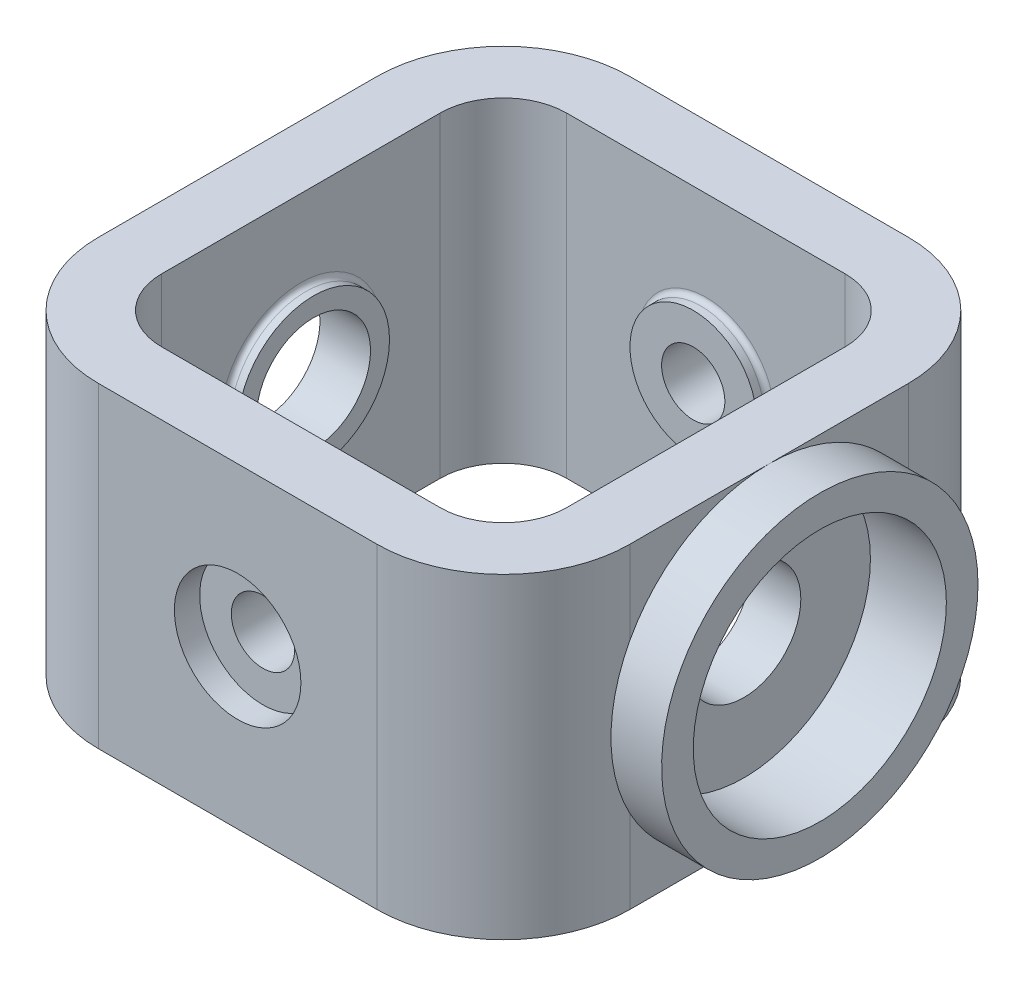
from build123d import *

# Parameters (mm, degrees)
RESSALTO_EXTRUS_O1_DEPTH = 12.5
ESBO_O5_R                = 5
RESSALTO_EXTRUS_O2_DEPTH = 1
ESBO_O6_R                = 5
RESSALTO_EXTRUS_O3_DEPTH = 1
ESBO_O2_R                = 2.5
CORTE_EXTRUS_O1_DEPTH    = 49.592694924
ESBO_O3_R                = 2.5
CORTE_EXTRUS_O2_DEPTH    = 49.592694924
ESBO_O7_R                = 5
CORTE_EXTRUS_O3_DEPTH    = 2
ESCALA1_SCALE            = 0.5
CROQUIS4_R               = 5
CORTAR_EXTRUIR3_DEPTH    = 1
CROQUIS9_R               = 2.25
CORTAR_EXTRUIR6_DEPTH    = 24.437416667
CROQUIS10_R              = 2.851109387
CORTAR_EXTRUIR7_DEPTH    = 16
CORTAR_EXTRUIR8_START    = -1
CROQUIS11_R              = 5
CORTAR_EXTRUIR8_DEPTH    = 1
CROQUIS13_R              = 2.5
CROQUIS13_R_2            = 1.25
CORTAR_EXTRUIR9_DEPTH    = 1
CROQUIS12_R              = 3
CROQUIS12_R_2            = 2.25
SALIENTE_EXTRUIR3_DEPTH  = 0.5
REDONDEO1_R              = 0.2
CROQUIS14_R              = 6.25
CROQUIS14_R_2            = 5
SALIENTE_EXTRUIR5_DEPTH  = 2


with BuildPart() as part:
    # Esboço1 → Ressalto-extrusão1 (new, symmetric)
    with BuildSketch(Plane(origin=(0, 0, 0), x_dir=(1, 0, 0), z_dir=(0, 1, 0))):
        with BuildLine():
            Line((-21, -11), (-21, 11))
            ThreePointArc((-21, 11), (-18.071067812, 18.071067812), (-11, 21))
            Line((-11, 21), (11, 21))
            ThreePointArc((11, 21), (18.071067812, 18.071067812), (21, 11))
            Line((21, 11), (21, -11))
            ThreePointArc((21, -11), (18.071067812, -18.071067812), (11, -21))
            Line((11, -21), (-11, -21))
            ThreePointArc((-11, -21), (-18.071067812, -18.071067812), (-21, -11))
        make_face()
        with BuildLine():
            Line((-11, -16), (11, -16))
            ThreePointArc((11, -16), (14.535533906, -14.535533906), (16, -11))
            Line((16, -11), (16, 11))
            ThreePointArc((16, 11), (14.535533906, 14.535533906), (11, 16))
            Line((11, 16), (-11, 16))
            ThreePointArc((-11, 16), (-14.535533906, 14.535533906), (-16, 11))
            Line((-16, 11), (-16, -11))
            ThreePointArc((-16, -11), (-14.535533906, -14.535533906), (-11, -16))
        make_face(mode=Mode.SUBTRACT)
    extrude(amount=RESSALTO_EXTRUS_O1_DEPTH, both=True)

    # Esboço5 → Ressalto-extrusão2 (add)
    with BuildSketch(Plane.XY.offset(-16)):
        Circle(ESBO_O5_R)
    ressalto_extrus_o2 = extrude(amount=RESSALTO_EXTRUS_O2_DEPTH)

    # Espelhar1: Ressalto-extrusão2 across plane
    add(ressalto_extrus_o2.mirror(Plane.XY))

    # Esboço6 → Ressalto-extrusão3 (add)
    with BuildSketch(Plane(origin=(-16, 0, 0), x_dir=(0, 0, -1), z_dir=(1, 0, 0))):
        Circle(ESBO_O6_R)
    ressalto_extrus_o3 = extrude(amount=RESSALTO_EXTRUS_O3_DEPTH)

    # Espelhar2: Ressalto-extrusão3 across plane
    add(ressalto_extrus_o3.mirror(Plane(origin=(0, 0, 0), x_dir=(0, 0, 1), z_dir=(1, 0, 0))))

    # Esboço2 → Corte-extrusão1 (cut, through all)
    with BuildSketch(Plane.XY.offset(21)):
        Circle(ESBO_O2_R)
    extrude(amount=-CORTE_EXTRUS_O1_DEPTH, mode=Mode.SUBTRACT)

    # Esboço3 → Corte-extrusão2 (cut, through all)
    with BuildSketch(Plane.ZY.offset(21)):
        Circle(ESBO_O3_R)
    extrude(amount=-CORTE_EXTRUS_O2_DEPTH, mode=Mode.SUBTRACT)

    # Esboço7 → Corte-extrusão3 (cut)
    with BuildSketch(Plane(origin=(21, 0, 0), x_dir=(0, 0, -1), z_dir=(1, 0, 0))):
        Circle(ESBO_O7_R)
    corte_extrus_o3 = extrude(amount=-CORTE_EXTRUS_O3_DEPTH, mode=Mode.SUBTRACT)

    # Espelhar3: Corte-extrusão3 across plane
    add(corte_extrus_o3.mirror(Plane(origin=(0, 0, 0), x_dir=(0, 0, 1), z_dir=(1, 0, 0))), mode=Mode.SUBTRACT)


with BuildPart() as part_1:
    # Escala1: scaled about (0, 0, 0)
    add(part.part.scale(ESCALA1_SCALE))

    # Croquis4 → Cortar-Extruir3 (cut)
    with BuildSketch(Plane.ZY.offset(10.5)):
        Circle(CROQUIS4_R)
    extrude(amount=-CORTAR_EXTRUIR3_DEPTH, mode=Mode.SUBTRACT)

    # Croquis9 → Cortar-Extruir6 (cut, through all)
    with BuildSketch(Plane.ZY.offset(9.5)):
        Circle(CROQUIS9_R)
    extrude(amount=-CORTAR_EXTRUIR6_DEPTH, mode=Mode.SUBTRACT)

    # Croquis10 → Cortar-Extruir7 (cut)
    with BuildSketch(Plane.ZY.offset(-8)):
        Circle(CROQUIS10_R)
    extrude(amount=CORTAR_EXTRUIR7_DEPTH, mode=Mode.SUBTRACT)

    # Croquis11 → Cortar-Extruir8 (cut)
    with BuildSketch(Plane(origin=(10.5, 0, 0), x_dir=(0, 0, -1), z_dir=(1, 0, 0)).offset(CORTAR_EXTRUIR8_START)):
        with Locations(Location((0, 0, 0), (0, 0, 180))):
            Circle(CROQUIS11_R)
    extrude(amount=CORTAR_EXTRUIR8_DEPTH, mode=Mode.SUBTRACT)

    # Croquis13 → Cortar-Extruir9 (cut)
    with BuildSketch(Plane.XY.offset(10.5)):
        Circle(CROQUIS13_R)
        Circle(CROQUIS13_R_2, mode=Mode.SUBTRACT)
    cortar_extruir9 = extrude(amount=-CORTAR_EXTRUIR9_DEPTH, mode=Mode.SUBTRACT)

    # Simetría4: Cortar-Extruir9 across plane
    add(cortar_extruir9.mirror(Plane.XY), mode=Mode.SUBTRACT)

    # Croquis12 → Saliente-Extruir3 (add)
    with BuildSketch(Plane(origin=(-8, 0, 0), x_dir=(0, 0, -1), z_dir=(1, 0, 0))):
        Circle(CROQUIS12_R)
        with Locations(Location((0, 0, 0), (0, 0, 180))):
            Circle(CROQUIS12_R_2, mode=Mode.SUBTRACT)
    saliente_extruir3 = extrude(amount=SALIENTE_EXTRUIR3_DEPTH)

    # Simetría5: Saliente-Extruir3 across plane
    add(saliente_extruir3.mirror(Plane(origin=(0, 0, 0), x_dir=(0, 0, 1), z_dir=(1, 0, 0))))

    # Redondeo1
    redondeo1_edges = [part_1.edges().sort_by_distance(p)[0] for p in [
        (-8, 0, 3),
        (8, 0, 3),
        (-2.5, 0, -8),
        (-2.5, 0, 8),
    ]]
    fillet(redondeo1_edges, radius=REDONDEO1_R)

    # Croquis14 → Saliente-Extruir5 (add)
    with BuildSketch(Plane(origin=(10.5, 0, 0), x_dir=(0, 0, -1), z_dir=(1, 0, 0))):
        with Locations(Location((0, 0, 0), (0, 0, 151.642363424))):
            Circle(CROQUIS14_R)
        with Locations(Location((0, 0, 0), (0, 0, 180))):
            Circle(CROQUIS14_R_2, mode=Mode.SUBTRACT)
    extrude(amount=SALIENTE_EXTRUIR5_DEPTH)


solid = part_1.part
